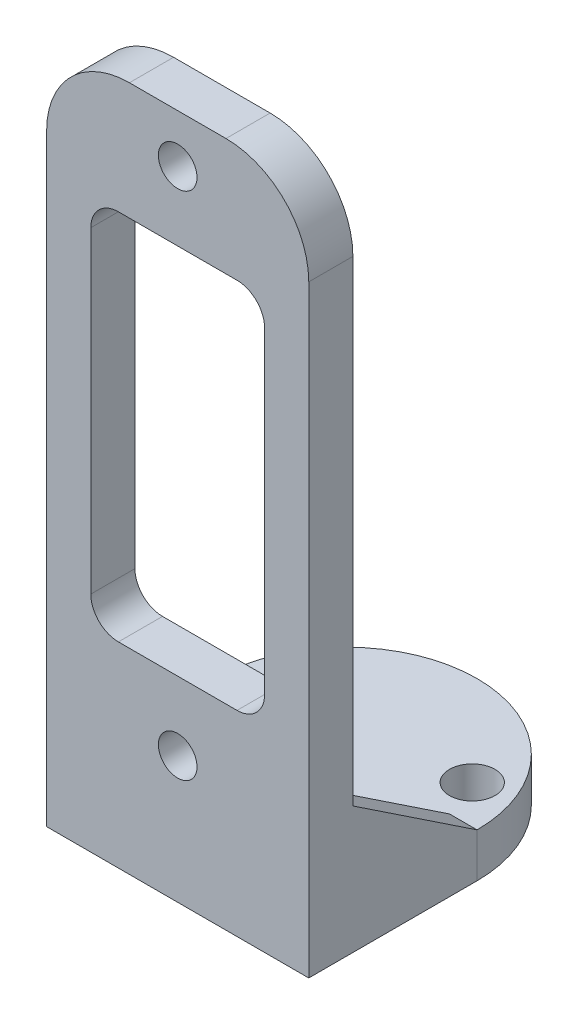
from build123d import *

# Parameters (mm, degrees)
SKETCH1_R               = 1.4
BOSS_EXTRUDE1_DEPTH     = 3.2
BOSS_EXTRUDE3_DEPTH     = 3.2
BOSS_EXTRUDE4_DEPTH     = 2
LPATTERN1_COUNT         = 2
LPATTERN1_PITCH         = 17
CUT_EXTRUDE1_DEPTH      = 54.530365215
CUT_EXTRUDE4_DEPTH      = 54.530365215
CUT_EXTRUDE4_DEPTH_BACK = 54.530365215
SKETCH8_R               = 1.65


with BuildPart() as part:
    # Sketch1 → Boss-Extrude1 (new body)
    with BuildSketch(Plane.XY):
        with BuildLine():
            Line((0, 0), (19, 0))
            Line((19, 0), (19, 40.5))
            ThreePointArc((19, 40.5), (17.242640687, 44.742640687), (13, 46.5))
            Line((13, 46.5), (6, 46.5))
            ThreePointArc((6, 46.5), (1.757359313, 44.742640687), (0, 40.5))
            Line((0, 40.5), (0, 0))
        make_face()
        with Locations((9.5, 6)):
            Circle(SKETCH1_R, mode=Mode.SUBTRACT)
        with Locations((9.5, 43)):
            Circle(SKETCH1_R, mode=Mode.SUBTRACT)
    extrude(amount=BOSS_EXTRUDE1_DEPTH)

    # Sketch2 → Boss-Extrude3 (add)
    with BuildSketch(Plane(origin=(0, 0, 0), x_dir=(1, 0, 0), z_dir=(0, 1, 0))):
        with BuildLine():
            Line((0, 9), (0, -3.2))
            Line((0, -3.2), (19, -3.2))
            Line((19, -3.2), (19, 9))
            ThreePointArc((19, 9), (9.5, 18.5), (0, 9))
        make_face()
    extrude(amount=-BOSS_EXTRUDE3_DEPTH)

    # Sketch3 → Boss-Extrude4 (add)
    with BuildSketch(Plane(origin=(0, 0, 0), x_dir=(0, 0, -1), z_dir=(1, 0, 0))):
        Polygon((0, 0), (9, 0), (0, 6), align=None)
    boss_extrude4 = extrude(amount=BOSS_EXTRUDE4_DEPTH)

    # LPattern1: Boss-Extrude4 ×2
    with Locations(*[(i * LPATTERN1_PITCH, 0, 0) for i in range(1, LPATTERN1_COUNT)]):
        add(boss_extrude4)

    # Sketch4 → Cut-Extrude1 (cut, through all)
    with BuildSketch(Plane.XY):
        with BuildLine():
            Line((5.2, 38), (13.8, 38))
            ThreePointArc((13.8, 38), (15.214213562, 37.414213562), (15.8, 36))
            Line((15.8, 36), (15.8, 13))
            ThreePointArc((15.8, 13), (15.214213562, 11.585786438), (13.8, 11))
            Line((13.8, 11), (5.2, 11))
            ThreePointArc((5.2, 11), (3.785786438, 11.585786438), (3.2, 13))
            Line((3.2, 13), (3.2, 36))
            ThreePointArc((3.2, 36), (3.785786438, 37.414213562), (5.2, 38))
        make_face()
    extrude(amount=CUT_EXTRUDE1_DEPTH, mode=Mode.SUBTRACT)

    # Sketch8 → Cut-Extrude4 (cut, two sides: drawn at the far end of the back side and taken through both)
    with BuildSketch(Plane(origin=(0, 0, 0), x_dir=(1, 0, 0), z_dir=(0, 1, 0)).offset(-CUT_EXTRUDE4_DEPTH_BACK)):
        with Locations(Location((3.15, 11.8, 0), (0, 0, 270))):
            Circle(SKETCH8_R)
        with Locations(Location((14.14852263, 5.45, 0), (0, 0, 270))):
            Circle(SKETCH8_R)
        with Locations(Location((4.85147737, 5.45, 0), (0, 0, 270))):
            Circle(SKETCH8_R)
        with Locations(Location((15.85, 11.8, 0), (0, 0, 270))):
            Circle(SKETCH8_R)
    extrude(amount=CUT_EXTRUDE4_DEPTH + CUT_EXTRUDE4_DEPTH_BACK, mode=Mode.SUBTRACT)


solid = part.part
